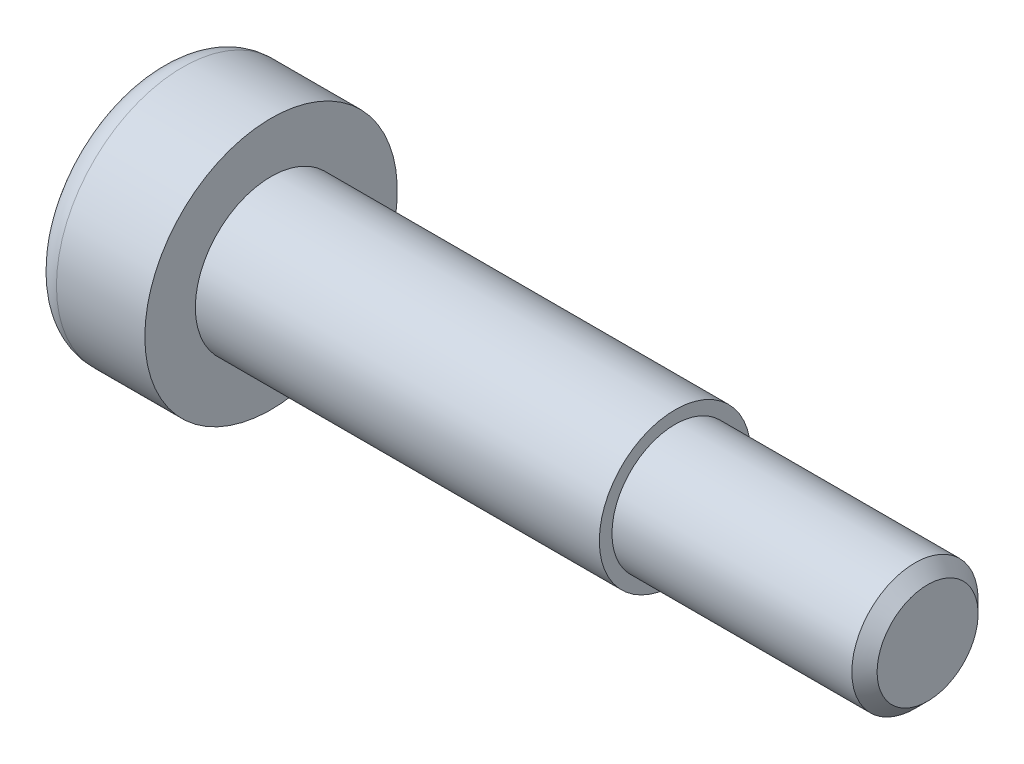
from build123d import *

# Parameters (mm, degrees)
CUT_EXTRUDE_1_DEPTH = 3
FILLET_1_R          = 1
CHAMFER_1_SIZE      = 0.5


with BuildPart() as part:
    # 草图1 → 旋转1 (revolve)
    with BuildSketch(Plane.XY, mode=Mode.PRIVATE) as revolve_1_sk:
        Polygon((0, 0), (0, 5), (4.5, 5), (4.5, 3), (20.5, 3), (20.5, 2.5), (30.5, 2.5), (30.5, 0), align=None)
    revolve(revolve_1_sk.sketch.rotate(Axis((0, 0, 0), (1, 0, 0)), 90), axis=Axis((0, 0, 0), (1, 0, 0)))

    # 草图2 → 切除-拉伸1 (cut)
    with BuildSketch(Plane.ZY):
        Polygon((0, 1.732050808), (-1.5, 0.866025404), (-1.5, -0.866025404), (0, -1.732050808), (1.5, -0.866025404), (1.5, 0.866025404), align=None)
    extrude(amount=-CUT_EXTRUDE_1_DEPTH, mode=Mode.SUBTRACT)

    # 圆角1
    fillet_1_edges = [part.edges().sort_by_distance(p)[0] for p in [
        (0, 0, -5),
    ]]
    fillet(fillet_1_edges, radius=FILLET_1_R)

    # 倒角1
    chamfer_1_edges = [part.edges().sort_by_distance(p)[0] for p in [
        (30.5, 0, -2.5),
    ]]
    chamfer(chamfer_1_edges, length=CHAMFER_1_SIZE)


solid = part.part
